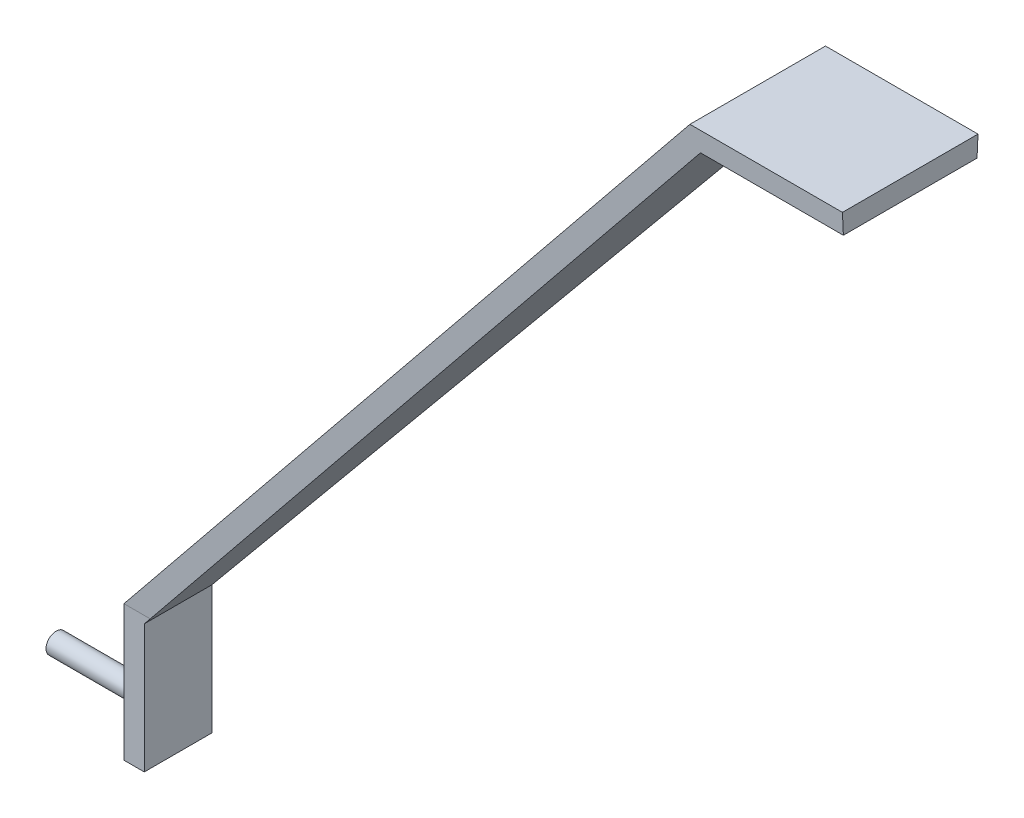
from build123d import *

# Parameters (mm, degrees)
BOSS_EXTRUDE1_DEPTH = 20
SKETCH6_W           = 5
SKETCH6_H           = 20
CUT_EXTRUDE1_DEPTH  = 293.280687012
SKETCH7_R           = 1.5
BOSS_EXTRUDE2_DEPTH = 15
BOSS_EXTRUDE3_START = 15
SKETCH8_R           = 1.5
BOSS_EXTRUDE3_DEPTH = 15
SKETCH9_W           = 68.096715613
SKETCH9_H           = 158.263972947
CUT_EXTRUDE2_DEPTH  = 153
SKETCH10_W          = 29.496800943
SKETCH10_H          = 9.142322102
CUT_EXTRUDE3_DEPTH  = 20


with BuildPart() as part:
    # Sketch5 → Boss-Extrude1 (new body)
    with BuildSketch(Plane.XY):
        Polygon((0, 0), (-42.5, 0), (-131, -108), (-131, -128), (-128, -128), (-128, -109.072168564), (-41.07975076, -3), (0, -3), align=None)
        Polygon((42.5, 0), (0, 0), (0, -3), (41.07975076, -3), (128, -109.072168564), (128, -128), (131, -128), (131, -108), align=None)
    extrude(amount=BOSS_EXTRUDE1_DEPTH)

    # Sketch6 → Cut-Extrude1 (cut, through all)
    with BuildSketch(Plane(origin=(131, 0, 0), x_dir=(0, 0, -1), z_dir=(1, 0, 0))):
        with Locations((-17.5, -118)):
            Rectangle(SKETCH6_W, SKETCH6_H)
        Polygon((-20, -108), (-15, -108), (-20, 0), align=None)
        Polygon((0, 0), (-5, -108), (0, -108), align=None)
        with Locations((-2.5, -118)):
            Rectangle(SKETCH6_W, SKETCH6_H)
    extrude(amount=-CUT_EXTRUDE1_DEPTH, mode=Mode.SUBTRACT)

    # Sketch7 → Boss-Extrude2 (add)
    with BuildSketch(Plane(origin=(131, 0, 0), x_dir=(0, 0, -1), z_dir=(1, 0, 0))):
        with Locations((-10, -123)):
            Circle(SKETCH7_R)
    extrude(amount=BOSS_EXTRUDE2_DEPTH)

    # Sketch8 → Boss-Extrude3 (add)
    with BuildSketch(Plane.ZY.offset(131).offset(BOSS_EXTRUDE3_START)):
        with Locations(Location((10, -123, 0), (0, 0, 180))):
            Circle(SKETCH8_R)
    extrude(amount=-BOSS_EXTRUDE3_DEPTH)

    # Sketch9 → Cut-Extrude2 (cut)
    with BuildSketch(Plane(origin=(0, 0, 0), x_dir=(0, 0, -1), z_dir=(1, 0, 0))):
        with Locations((10.702862104, -71.494594105)):
            Rectangle(SKETCH9_W, SKETCH9_H)
    extrude(amount=CUT_EXTRUDE2_DEPTH, mode=Mode.SUBTRACT)

    # Sketch10 → Cut-Extrude3 (cut)
    with BuildSketch(Plane(origin=(0, 0, 0), x_dir=(0, 0, -1), z_dir=(1, 0, 0))):
        with Locations((-8.497508997, -2.151596762)):
            Rectangle(SKETCH10_W, SKETCH10_H)
    extrude(amount=-CUT_EXTRUDE3_DEPTH, mode=Mode.SUBTRACT)


solid = part.part
